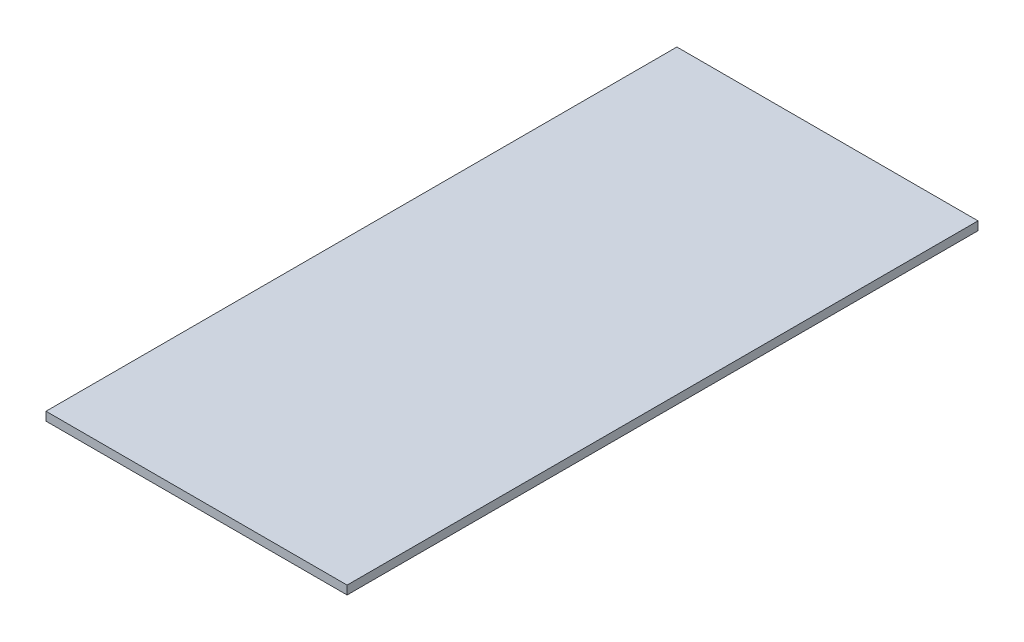
from build123d import *

# Parameters (mm, degrees)
SKETCH1_W           = 105
SKETCH1_H           = 220
BOSS_EXTRUDE1_DEPTH = 3


with BuildPart() as part:
    # Sketch1 → Boss-Extrude1 (new body)
    with BuildSketch(Plane(origin=(0, 0, 0), x_dir=(1, 0, 0), z_dir=(0, 1, 0))):
        Rectangle(SKETCH1_W, SKETCH1_H)
    extrude(amount=BOSS_EXTRUDE1_DEPTH)


solid = part.part
